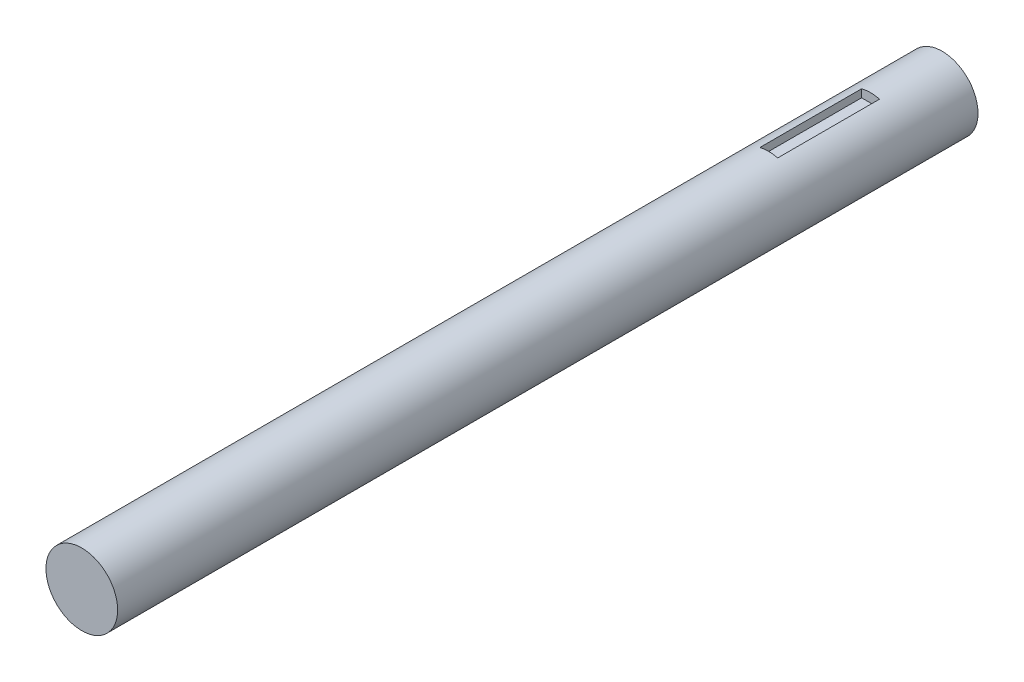
from build123d import *

# Parameters (mm, degrees)
SKETCH1_R           = 6.35
BOSS_EXTRUDE1_DEPTH = 152.4
CUT_EXTRUDE1_DEPTH  = 18.034


with BuildPart() as part:
    # Sketch1 → Boss-Extrude1 (new body)
    with BuildSketch(Plane.XY):
        with Locations(Location((0, 0, 0), (0, 0, 180))):
            Circle(SKETCH1_R)
    extrude(amount=BOSS_EXTRUDE1_DEPTH)

    # Sketch2 → Cut-Extrude1 (cut)
    with BuildSketch(Plane(origin=(0, 0, 12.7), x_dir=(-1, 0, 0), z_dir=(0, 0, -1))):
        Polygon((1.571433325, 4.7625), (-0.016066675, 4.7625), (-1.603566675, 4.7625), (-1.603566675, 7.9375), (1.571433325, 7.9375), align=None)
    extrude(amount=-CUT_EXTRUDE1_DEPTH, mode=Mode.SUBTRACT)


solid = part.part
